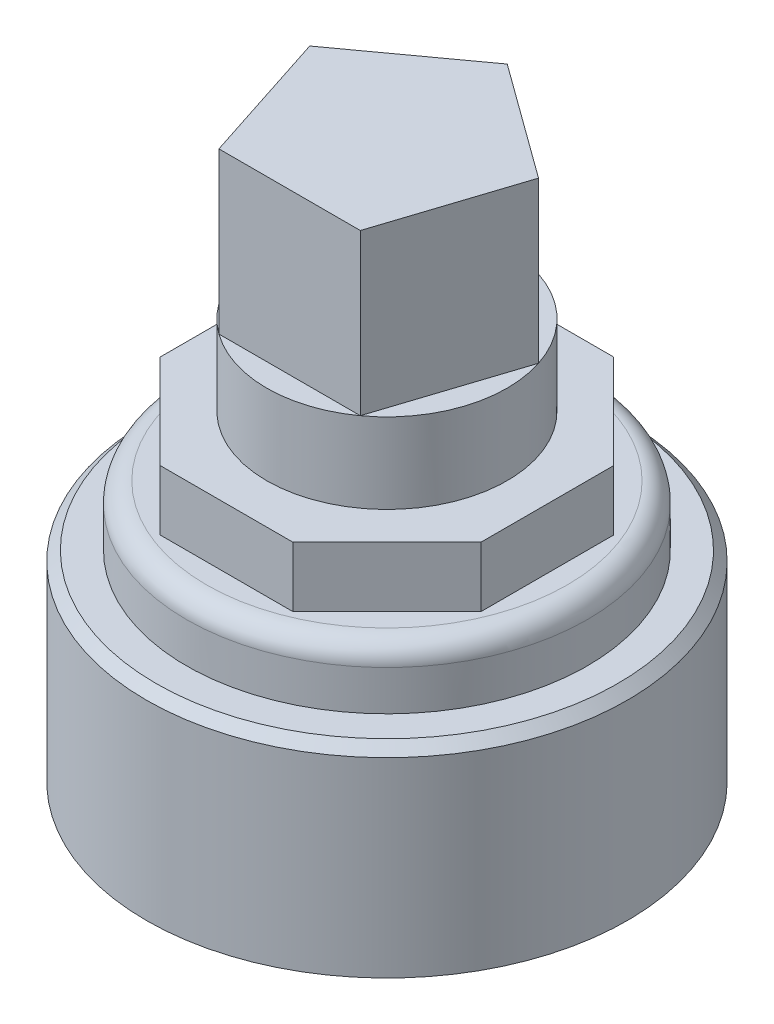
from build123d import *

# Parameters (mm, degrees)
SKETCH2_R           = 38.1
BOSS_EXTRUDE1_DEPTH = 31.75
CHAMFER1_SIZE       = 1.524
SKETCH3_R           = 31.75
BOSS_EXTRUDE3_DEPTH = 9.525
FILLET1_R           = 3.175
BOSS_EXTRUDE4_DEPTH = 9.525
SKETCH5_R           = 19.05
BOSS_EXTRUDE5_DEPTH = 12.7
BOSS_EXTRUDE6_DEPTH = 25.4


with BuildPart() as part:
    # Sketch2 → Boss-Extrude1 (new body)
    with BuildSketch(Plane(origin=(0, 0, 0), x_dir=(1, 0, 0), z_dir=(0, 1, 0))):
        with Locations(Location((0, 0, 0), (0, 0, 270))):
            Circle(SKETCH2_R)
    extrude(amount=BOSS_EXTRUDE1_DEPTH)

    # Chamfer1
    chamfer1_edges = [part.edges().sort_by_distance(p)[0] for p in [
        (0, 31.75, -38.1),
    ]]
    chamfer(chamfer1_edges, length=CHAMFER1_SIZE)

    # Sketch3 → Boss-Extrude3 (add)
    with BuildSketch(Plane(origin=(0, 31.75, 0), x_dir=(1, 0, 0), z_dir=(0, 1, 0))):
        with Locations(Location((0, 0, 0), (0, 0, 90))):
            Circle(SKETCH3_R)
    extrude(amount=BOSS_EXTRUDE3_DEPTH)

    # Fillet1
    fillet1_edges = [part.edges().sort_by_distance(p)[0] for p in [
        (0, 41.275, 31.75),
    ]]
    fillet(fillet1_edges, radius=FILLET1_R)

    # Sketch4 → Boss-Extrude4 (add)
    with BuildSketch(Plane(origin=(0, 41.275, 0), x_dir=(1, 0, 0), z_dir=(0, 1, 0))):
        Polygon((25.4, 10.521024484), (10.521024484, 25.4), (-10.521024484, 25.4), (-25.4, 10.521024484), (-25.4, -10.521024484), (-10.521024484, -25.4), (10.521024484, -25.4), (25.4, -10.521024484), align=None)
    extrude(amount=BOSS_EXTRUDE4_DEPTH)

    # Sketch5 → Boss-Extrude5 (add)
    with BuildSketch(Plane(origin=(0, 50.8, 0), x_dir=(1, 0, 0), z_dir=(0, 1, 0))):
        with Locations(Location((0, 0, 0), (0, 0, 270))):
            Circle(SKETCH5_R)
    extrude(amount=BOSS_EXTRUDE5_DEPTH)

    # Sketch6 → Boss-Extrude6 (add)
    with BuildSketch(Plane(origin=(0, 63.5, 0), x_dir=(1, 0, 0), z_dir=(0, 1, 0))):
        Polygon((-11.197309056, -15.411773743), (11.197309056, -15.411773743), (18.117626635, 5.886773743), (0, 19.05), (-18.117626635, 5.886773743), align=None)
    extrude(amount=BOSS_EXTRUDE6_DEPTH)


solid = part.part
